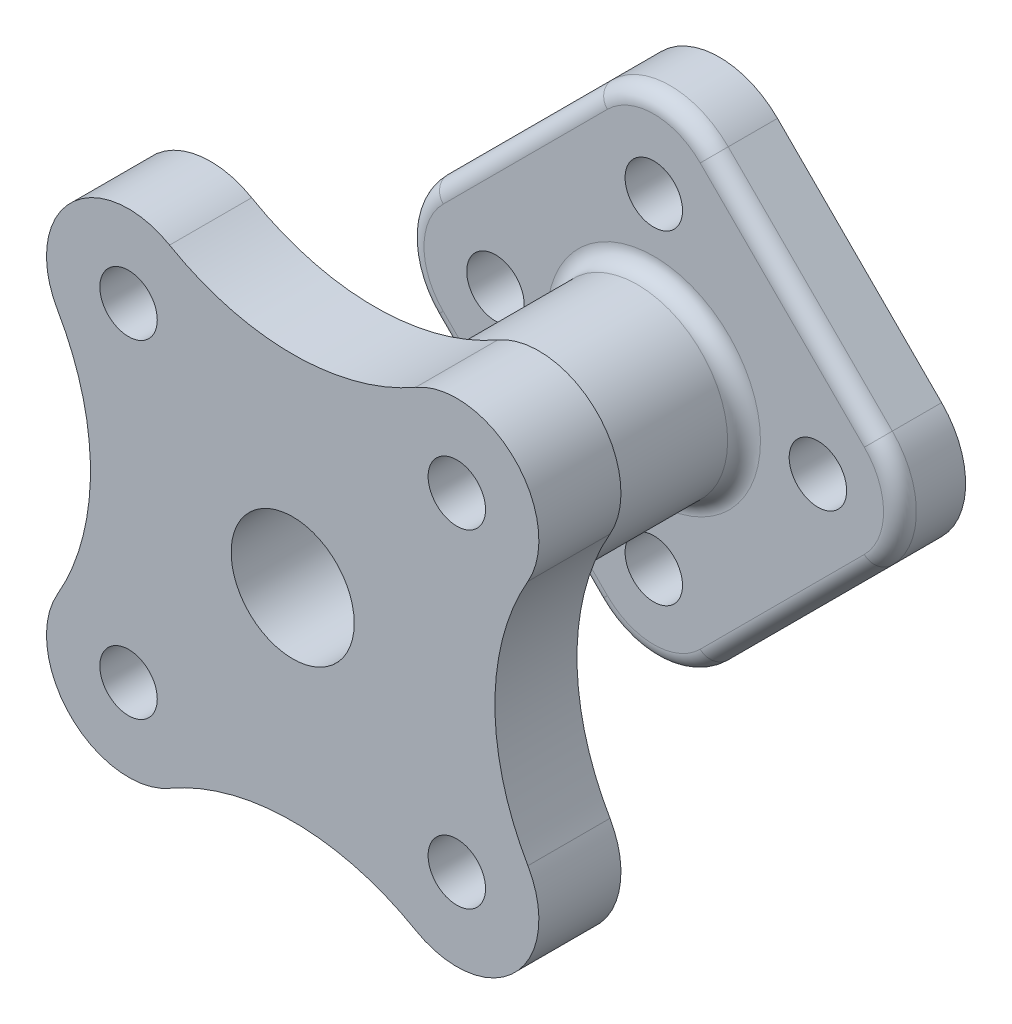
from build123d import *

# Parameters (mm, degrees)
EXTRUDE_1_DEPTH     = 12.7
SKETCH_2_R          = 13.97
EXTRUDE_2_DEPTH     = 43.18
EXTRUDE_3_DEPTH     = 10.16
SKETCH_5_R          = 9.525
CUT_EXTRUDE_1_DEPTH = 86.232045617
CUT_EXTRUDE_2_REACH = 87.232
SKETCH_6_R          = 4.445
CUT_EXTRUDE_3_REACH = 79.626
SKETCH_7_R          = 4.445
FILLET_1_R          = 2.54


with BuildPart() as part:
    # 스케치1 → 보스-돌출1 (new body)
    with BuildSketch(Plane.XY):
        with BuildLine():
            ThreePointArc((-19.05, 36.398522628), (-34.380256121, 34.380256121), (-36.398522628, 19.05))
            ThreePointArc((-36.398522628, 19.05), (-31.294090512, 0), (-36.398522628, -19.05))
            ThreePointArc((-36.398522628, -19.05), (-34.380256121, -34.380256121), (-19.05, -36.398522628))
            ThreePointArc((-19.05, -36.398522628), (0, -31.294090512), (19.05, -36.398522628))
            ThreePointArc((19.05, -36.398522628), (34.380256121, -34.380256121), (36.398522628, -19.05))
            ThreePointArc((36.398522628, -19.05), (31.294090512, 0), (36.398522628, 19.05))
            ThreePointArc((36.398522628, 19.05), (34.380256121, 34.380256121), (19.05, 36.398522628))
            ThreePointArc((19.05, 36.398522628), (0, 31.294090512), (-19.05, 36.398522628))
        make_face()
    extrude(amount=-EXTRUDE_1_DEPTH)

    # 스케치2 → 보스-돌출2 (add)
    with BuildSketch(Plane(origin=(0, 0, -12.7), x_dir=(-1, 0, 0), z_dir=(0, 0, -1))):
        Circle(SKETCH_2_R)
    extrude(amount=EXTRUDE_2_DEPTH)

    # 스케치4 → 보스-돌출3 (add)
    with BuildSketch(Plane(origin=(0, 0, -55.88), x_dir=(-1, 0, 0), z_dir=(0, 0, -1))):
        with BuildLine():
            Line((-34.380256121, 8.980256121), (-8.980256121, 34.380256121))
            ThreePointArc((-8.980256121, 34.380256121), (0, 38.1), (8.980256121, 34.380256121))
            Line((8.980256121, 34.380256121), (34.380256121, 8.980256121))
            ThreePointArc((34.380256121, 8.980256121), (38.1, 0), (34.380256121, -8.980256121))
            Line((34.380256121, -8.980256121), (8.980256121, -34.380256121))
            ThreePointArc((8.980256121, -34.380256121), (0, -38.1), (-8.980256121, -34.380256121))
            Line((-8.980256121, -34.380256121), (-34.380256121, -8.980256121))
            ThreePointArc((-34.380256121, -8.980256121), (-38.1, 0), (-34.380256121, 8.980256121))
        make_face()
    extrude(amount=EXTRUDE_3_DEPTH)

    # 스케치5 → 컷-돌출1 (cut, through all)
    with BuildSketch(Plane.XY):
        Circle(SKETCH_5_R)
    extrude(amount=-CUT_EXTRUDE_1_DEPTH, mode=Mode.SUBTRACT)

    # 스케치6 → 컷-돌출2 (cut, up to next)
    with BuildSketch(Plane.XY, mode=Mode.PRIVATE) as cut_extrude_2_sk1:
        with Locations((-25.4, 25.4)):
            Circle(SKETCH_6_R)
    cut_extrude_2_tool1 = extrude(cut_extrude_2_sk1.sketch, amount=-CUT_EXTRUDE_2_REACH, mode=Mode.PRIVATE) & part.part
    # 스케치6 → 컷-돌출2 (cut, up to next)
    with BuildSketch(Plane.XY, mode=Mode.PRIVATE) as cut_extrude_2_sk2:
        with Locations((-25.4, -25.4)):
            Circle(SKETCH_6_R)
    cut_extrude_2_tool2 = extrude(cut_extrude_2_sk2.sketch, amount=-CUT_EXTRUDE_2_REACH, mode=Mode.PRIVATE) & part.part
    # 스케치6 → 컷-돌출2 (cut, up to next)
    with BuildSketch(Plane.XY, mode=Mode.PRIVATE) as cut_extrude_2_sk3:
        with Locations((25.4, -25.4)):
            Circle(SKETCH_6_R)
    cut_extrude_2_tool3 = extrude(cut_extrude_2_sk3.sketch, amount=-CUT_EXTRUDE_2_REACH, mode=Mode.PRIVATE) & part.part
    # 스케치6 → 컷-돌출2 (cut, up to next)
    with BuildSketch(Plane.XY, mode=Mode.PRIVATE) as cut_extrude_2_sk4:
        with Locations((25.4, 25.4)):
            Circle(SKETCH_6_R)
    cut_extrude_2_tool4 = extrude(cut_extrude_2_sk4.sketch, amount=-CUT_EXTRUDE_2_REACH, mode=Mode.PRIVATE) & part.part
    add(cut_extrude_2_tool1.solids().sort_by_distance((-25.4, 25.4, 0))[0], mode=Mode.SUBTRACT)
    add(cut_extrude_2_tool2.solids().sort_by_distance((-25.4, -25.4, 0))[0], mode=Mode.SUBTRACT)
    add(cut_extrude_2_tool3.solids().sort_by_distance((25.4, -25.4, 0))[0], mode=Mode.SUBTRACT)
    add(cut_extrude_2_tool4.solids().sort_by_distance((25.4, 25.4, 0))[0], mode=Mode.SUBTRACT)

    # 스케치7 → 컷-돌출3 (cut, up to next)
    with BuildSketch(Plane.XY.offset(-55.88), mode=Mode.PRIVATE) as cut_extrude_3_sk1:
        with Locations((0, 24.823944536)):
            Circle(SKETCH_7_R)
    cut_extrude_3_tool1 = extrude(cut_extrude_3_sk1.sketch, amount=-CUT_EXTRUDE_3_REACH, mode=Mode.PRIVATE) & part.part
    # 스케치7 → 컷-돌출3 (cut, up to next)
    with BuildSketch(Plane.XY.offset(-55.88), mode=Mode.PRIVATE) as cut_extrude_3_sk2:
        with Locations((25.4, 0)):
            Circle(SKETCH_7_R)
    cut_extrude_3_tool2 = extrude(cut_extrude_3_sk2.sketch, amount=-CUT_EXTRUDE_3_REACH, mode=Mode.PRIVATE) & part.part
    # 스케치7 → 컷-돌출3 (cut, up to next)
    with BuildSketch(Plane.XY.offset(-55.88), mode=Mode.PRIVATE) as cut_extrude_3_sk3:
        with Locations((0, -25.4)):
            Circle(SKETCH_7_R)
    cut_extrude_3_tool3 = extrude(cut_extrude_3_sk3.sketch, amount=-CUT_EXTRUDE_3_REACH, mode=Mode.PRIVATE) & part.part
    # 스케치7 → 컷-돌출3 (cut, up to next)
    with BuildSketch(Plane.XY.offset(-55.88), mode=Mode.PRIVATE) as cut_extrude_3_sk4:
        with Locations((-24.501420948, 0)):
            Circle(SKETCH_7_R)
    cut_extrude_3_tool4 = extrude(cut_extrude_3_sk4.sketch, amount=-CUT_EXTRUDE_3_REACH, mode=Mode.PRIVATE) & part.part
    add(cut_extrude_3_tool1.solids().sort_by_distance((0, 24.823945, -55.88))[0], mode=Mode.SUBTRACT)
    add(cut_extrude_3_tool2.solids().sort_by_distance((25.4, 0, -55.88))[0], mode=Mode.SUBTRACT)
    add(cut_extrude_3_tool3.solids().sort_by_distance((0, -25.4, -55.88))[0], mode=Mode.SUBTRACT)
    add(cut_extrude_3_tool4.solids().sort_by_distance((-24.501421, 0, -55.88))[0], mode=Mode.SUBTRACT)

    # 필렛1
    fillet_1_edges = [part.edges().sort_by_distance(p)[0] for p in [
        (13.97, 0, -55.88),
        (-38.1, 0, -55.88),
        (-21.680256121, 21.680256121, -55.88),
        (0, 38.1, -55.88),
        (21.680256121, 21.680256121, -55.88),
        (38.1, 0, -55.88),
        (21.680256121, -21.680256121, -55.88),
        (0, -38.1, -55.88),
        (-21.680256121, -21.680256121, -55.88),
    ]]
    fillet(fillet_1_edges, radius=FILLET_1_R)


solid = part.part
